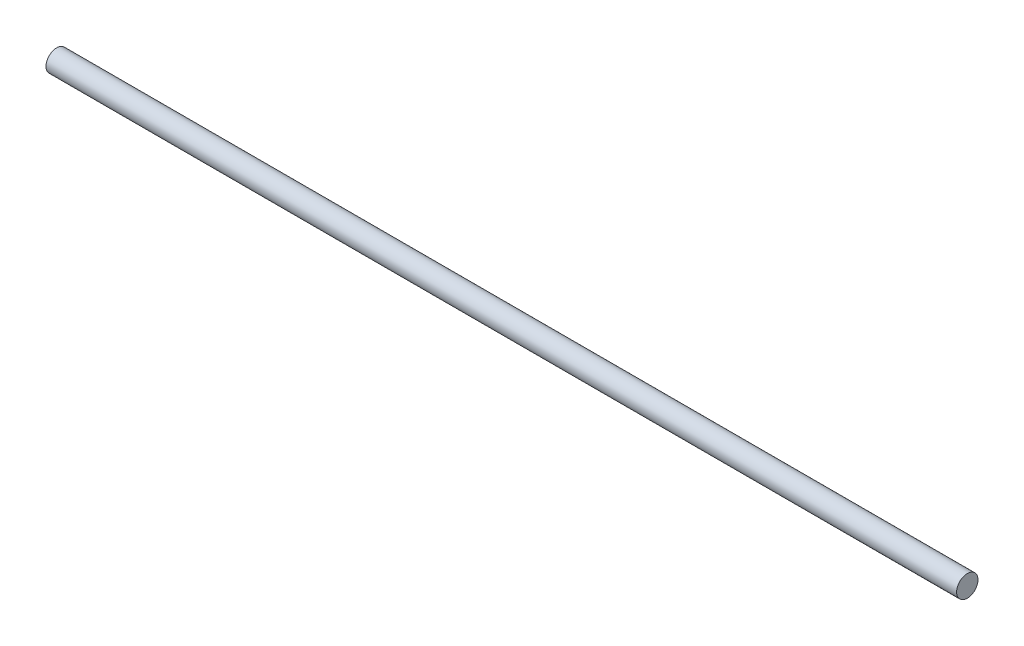
from build123d import *

# Parameters (mm, degrees)
SKETCH1_R           = 4
BOSS_EXTRUDE1_DEPTH = 340


with BuildPart() as part:
    # Sketch1 → Boss-Extrude1 (new body)
    with BuildSketch(Plane(origin=(0, 0, 0), x_dir=(0, 0, -1), z_dir=(1, 0, 0))):
        Circle(SKETCH1_R)
    extrude(amount=BOSS_EXTRUDE1_DEPTH)


solid = part.part
